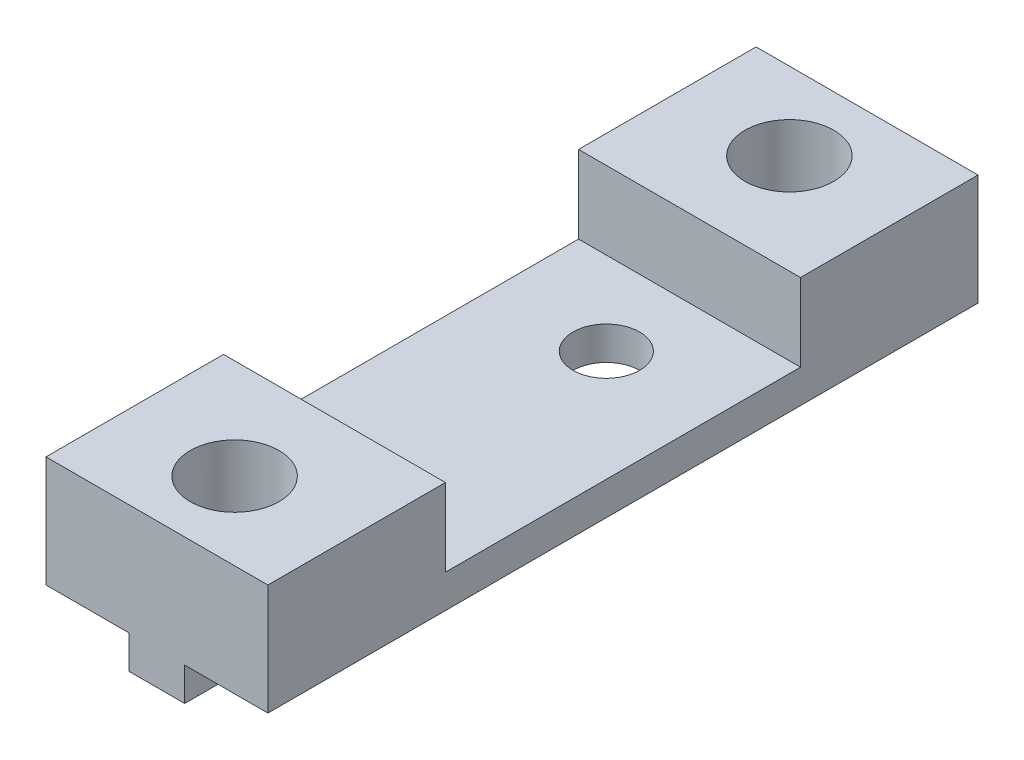
from build123d import *

# Parameters (mm, degrees)
SKETCH1_W               = 20
SKETCH1_H               = 30
BOSS_EXTRUDE1_DEPTH     = 3
SKETCH2_W               = 5
SKETCH2_H               = 12
BOSS_EXTRUDE2_DEPTH     = 3
SKETCH3_R               = 7
SKETCH3_R_2             = 4
BOSS_EXTRUDE3_DEPTH     = 7
SKETCH4_R               = 4
BOSS_EXTRUDE4_DEPTH     = 1
CUT_EXTRUDE1_DEPTH      = 20.339079606
CUT_EXTRUDE1_DEPTH_BACK = 20.339079606
SKETCH5_R               = 3
SKETCH6_R               = 7
SKETCH6_R_2             = 4
BOSS_EXTRUDE6_DEPTH     = 7
SKETCH7_W               = 20
SKETCH7_H               = 3
BOSS_EXTRUDE7_DEPTH     = 19
SKETCH8_W               = 5
SKETCH8_H               = 3
BOSS_EXTRUDE8_DEPTH     = 12
CUT_EXTRUDE2_START      = -1.5
SKETCH10_R              = 4
CUT_EXTRUDE2_DEPTH      = 1.5


with BuildPart() as part:
    # Sketch1 → Boss-Extrude1 (new body)
    with BuildSketch(Plane(origin=(0, 0, 0), x_dir=(1, 0, 0), z_dir=(0, 1, 0))):
        Rectangle(SKETCH1_W, SKETCH1_H)
    boss_extrude1 = extrude(amount=BOSS_EXTRUDE1_DEPTH)

    # Sketch2 → Boss-Extrude2 (add)
    with BuildSketch(Plane.XZ):
        with Locations((0, -9)):
            Rectangle(SKETCH2_W, SKETCH2_H)
    boss_extrude2 = extrude(amount=BOSS_EXTRUDE2_DEPTH)

    # Sketch3 → Boss-Extrude3 (add)
    with BuildSketch(Plane(origin=(0, 3, 0), x_dir=(1, 0, 0), z_dir=(0, 1, 0))):
        with Locations(Location((0, 8, 0), (0, 0, 90))):
            Circle(SKETCH3_R)
        with Locations(Location((0, 8, 0), (0, 0, 270))):
            Circle(SKETCH3_R_2, mode=Mode.SUBTRACT)
    boss_extrude3 = extrude(amount=BOSS_EXTRUDE3_DEPTH)

    # Sketch4 → Boss-Extrude4 (add)
    with BuildSketch(Plane(origin=(0, 3, 0), x_dir=(1, 0, 0), z_dir=(0, 1, 0))):
        with Locations(Location((0, 8, 0), (0, 0, 270))):
            Circle(SKETCH4_R)
    boss_extrude4 = extrude(amount=BOSS_EXTRUDE4_DEPTH)

    # Sketch5 → Cut-Extrude1 (cut, two sides: drawn at the far end of the back side and taken through both)
    with BuildSketch(Plane(origin=(0, 3, 0), x_dir=(1, 0, 0), z_dir=(0, 1, 0)).offset(-CUT_EXTRUDE1_DEPTH_BACK)):
        with Locations(Location((0, -8.5, 0), (0, 0, 90))):
            Circle(SKETCH5_R)
    extrude(amount=CUT_EXTRUDE1_DEPTH + CUT_EXTRUDE1_DEPTH_BACK, mode=Mode.SUBTRACT)

    # Sketch6 → Boss-Extrude6 (add)
    # profile 1 of 2: a face of its own
    with BuildSketch(Plane(origin=(0, 3, 0), x_dir=(1, 0, 0), z_dir=(0, 1, 0))):
        Polygon((0, 15), (-10, 15), (-10, -1), (10, -1), (10, 15), align=None)
        with BuildLine():
            ThreePointArc((7, 8), (-4.949747468, 3.050252532), (0, 15))
            ThreePointArc((0, 15), (4.949747468, 12.949747468), (7, 8))
        make_face(mode=Mode.SUBTRACT)
    # profile 2 of 2: a face of its own
    with BuildSketch(Plane(origin=(0, 3, 0), x_dir=(1, 0, 0), z_dir=(0, 1, 0))):
        with Locations((0, 8)):
            Circle(SKETCH6_R)
        with Locations(Location((0, 8, 0), (0, 0, 270))):
            Circle(SKETCH6_R_2, mode=Mode.SUBTRACT)
    boss_extrude6 = extrude(amount=BOSS_EXTRUDE6_DEPTH)

    # Sketch7 → Boss-Extrude7 (add)
    with BuildSketch(Plane.XY.offset(15)):
        with Locations((0, 1.5)):
            Rectangle(SKETCH7_W, SKETCH7_H)
    extrude(amount=BOSS_EXTRUDE7_DEPTH)

    # Mirror3: Boss-Extrude1, Boss-Extrude2, Boss-Extrude3, Boss-Extrude4, Boss-Extrude6 across plane
    add(boss_extrude1.mirror(Plane.XY.offset(17)))
    add(boss_extrude2.mirror(Plane.XY.offset(17)))
    add(boss_extrude3.mirror(Plane.XY.offset(17)))
    add(boss_extrude4.mirror(Plane.XY.offset(17)))
    add(boss_extrude6.mirror(Plane.XY.offset(17)))

    # Sketch8 → Boss-Extrude8 (add)
    with BuildSketch(Plane(origin=(0, 0, 37), x_dir=(-1, 0, 0), z_dir=(0, 0, -1))):
        with Locations((0, -1.5)):
            Rectangle(SKETCH8_W, SKETCH8_H)
    extrude(amount=BOSS_EXTRUDE8_DEPTH)

    # Sketch10 → Cut-Extrude2 (cut)
    with BuildSketch(Plane(origin=(0, 4, 0), x_dir=(1, 0, 0), z_dir=(0, 1, 0)).offset(CUT_EXTRUDE2_START)):
        with Locations(Location((0, 8, 0), (0, 0, 270))):
            Circle(SKETCH10_R)
        with Locations(Location((0, -42, 0), (0, 0, 90))):
            Circle(SKETCH10_R)
    extrude(amount=CUT_EXTRUDE2_DEPTH, mode=Mode.SUBTRACT)


solid = part.part
